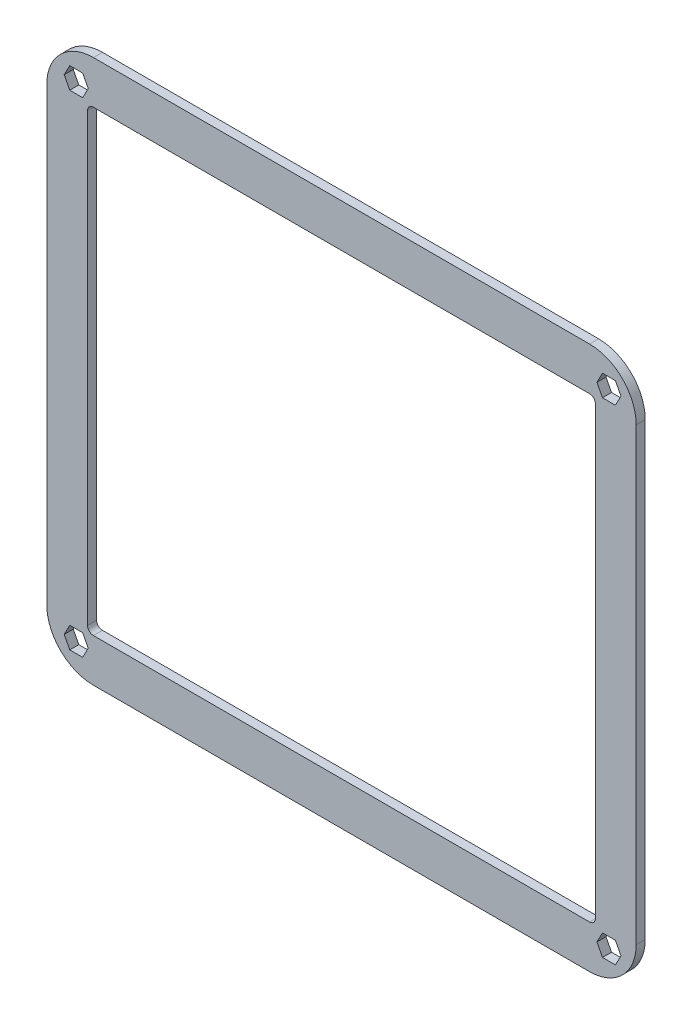
from build123d import *

# Parameters (mm, degrees)
AUFSATZ_LINEAR_AUSTRAGEN1_DEPTH = 2


with BuildPart() as part:
    # Skizze1 → Aufsatz-Linear austragen1 (new body)
    with BuildSketch(Plane.XY):
        with BuildLine():
            Line((-49.2275, -51.8905), (-49.2275, -151.2967))
            ThreePointArc((-49.2275, -151.2967), (-52.244300154, -158.579899846), (-59.5275, -161.5967))
            Line((-59.5275, -161.5967), (-169.0581, -161.5967))
            ThreePointArc((-169.0581, -161.5967), (-176.514004305, -158.403485592), (-179.34742314, -150.803560266))
            Line((-179.34742314, -150.803560266), (-179.34742314, -52.3842))
            ThreePointArc((-179.34742314, -52.3842), (-176.514207067, -44.783915623), (-169.0581, -41.5905))
            Line((-169.0581, -41.5905), (-59.5275, -41.5905))
            ThreePointArc((-59.5275, -41.5905), (-52.244300154, -44.607300154), (-49.2275, -51.8905))
        make_face()
        with BuildLine():
            Line((-59.5275, -152.0967), (-169.0581, -152.0967))
            ThreePointArc((-169.0581, -152.0967), (-169.972884043, -151.717784043), (-170.3518, -150.803))
            Line((-170.3518, -150.803), (-170.3518, -52.3842))
            ThreePointArc((-170.3518, -52.3842), (-169.972884043, -51.469415957), (-169.0581, -51.0905))
            Line((-169.0581, -51.0905), (-59.5275, -51.0905))
            ThreePointArc((-59.5275, -51.0905), (-58.612715957, -51.469415957), (-58.2338, -52.3842))
            Line((-58.2338, -52.3842), (-58.2338, -150.803))
            ThreePointArc((-58.2338, -150.803), (-58.612715957, -151.717784043), (-59.5275, -152.0967))
        make_face(mode=Mode.SUBTRACT)
        Polygon((-57.8838, -155.0967), (-56.659055129, -152.7467), (-53.808544871, -152.7467), (-52.5838, -155.0967), (-53.808544871, -157.4467), (-56.659055129, -157.4467), align=None, mode=Mode.SUBTRACT)
        Polygon((-171.422168012, -157.4467), (-170.19742314, -155.0967), (-171.422168012, -152.7467), (-174.272678269, -152.7467), (-175.49742314, -155.0967), (-174.272678269, -157.4467), align=None, mode=Mode.SUBTRACT)
        Polygon((-175.49742314, -48.0905), (-174.272678269, -45.7405), (-171.422168012, -45.7405), (-170.19742314, -48.0905), (-171.422168012, -50.4405), (-174.272678269, -50.4405), align=None, mode=Mode.SUBTRACT)
        Polygon((-57.8838, -48.0905), (-56.659055129, -45.7405), (-53.808544871, -45.7405), (-52.5838, -48.0905), (-53.808544871, -50.4405), (-56.659055129, -50.4405), align=None, mode=Mode.SUBTRACT)
    extrude(amount=AUFSATZ_LINEAR_AUSTRAGEN1_DEPTH)


solid = part.part
